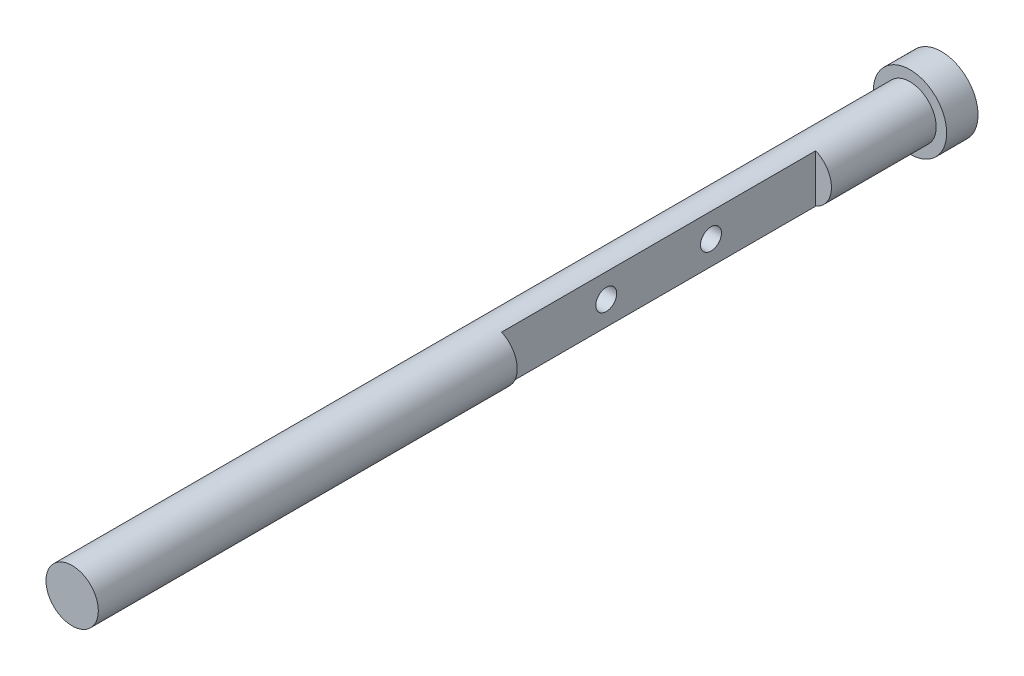
from build123d import *

# Parameters (mm, degrees)
ESQUISSE1_R             = 2.5
BOSS_EXTRU_1_DEPTH      = 80
ESQUISSE2_R             = 3.5
BOSS_EXTRU_2_DEPTH      = 3
ESQUISSE3_W             = 30
ESQUISSE3_H             = 5
ENL_V_MAT_EXTRU_1_DEPTH = 3
ESQUISSE4_R             = 1
ENL_V_MAT_EXTRU_2_DEPTH = 1.5


with BuildPart() as part:
    # Esquisse1 → Boss.-Extru.1 (new body)
    with BuildSketch(Plane.XY):
        Circle(ESQUISSE1_R)
    extrude(amount=BOSS_EXTRU_1_DEPTH)

    # Esquisse2 → Boss.-Extru.2 (add)
    with BuildSketch(Plane(origin=(0, 0, 0), x_dir=(-1, 0, 0), z_dir=(0, 0, -1))):
        Circle(ESQUISSE2_R)
    extrude(amount=BOSS_EXTRU_2_DEPTH)

    # Esquisse3 → Enlèv. mat.-Extru.1 (cut)
    with BuildSketch(Plane(origin=(1, 0, 0), x_dir=(0, 0, -1), z_dir=(1, 0, 0))):
        with Locations((-25, 0)):
            Rectangle(ESQUISSE3_W, ESQUISSE3_H)
    extrude(amount=ENL_V_MAT_EXTRU_1_DEPTH, mode=Mode.SUBTRACT)

    # Esquisse4 → Enlèv. mat.-Extru.2 (cut)
    with BuildSketch(Plane(origin=(1, 0, 0), x_dir=(0, 0, -1), z_dir=(1, 0, 0))):
        with Locations((-30, 0)):
            Circle(ESQUISSE4_R)
        with Locations((-20, 0)):
            Circle(ESQUISSE4_R)
    extrude(amount=-ENL_V_MAT_EXTRU_2_DEPTH, mode=Mode.SUBTRACT)


solid = part.part
